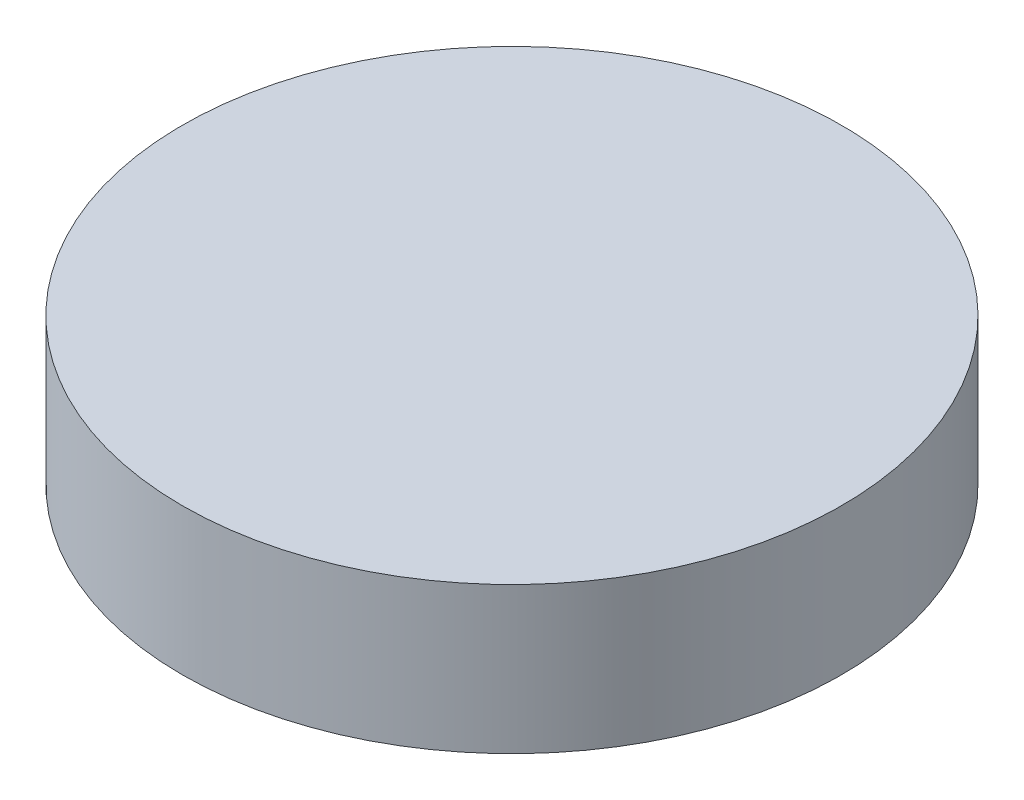
from build123d import *

# Parameters (mm, degrees)
SKETCH_1_R      = 0.9
EXTRUDE_1_DEPTH = 0.4


with BuildPart() as part:
    # 草图1 → 凸台-拉伸1 (new body)
    with BuildSketch(Plane(origin=(0, 0, 0), x_dir=(1, 0, 0), z_dir=(0, 1, 0))):
        with Locations(Location((0, 0, 0), (0, 0, 270))):
            Circle(SKETCH_1_R)
    extrude(amount=EXTRUDE_1_DEPTH)


solid = part.part
